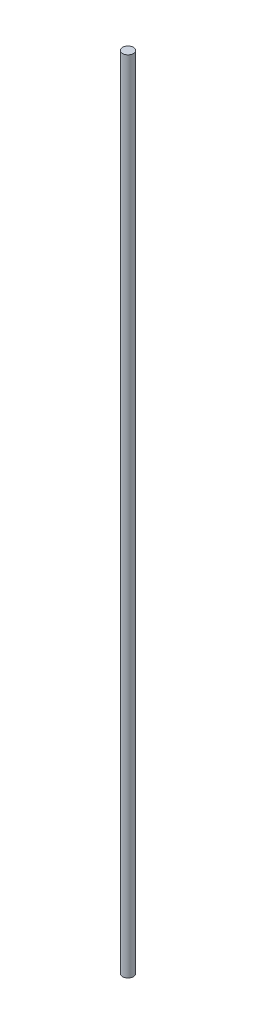
from build123d import *

# Parameters (mm, degrees)
SKETCH1_R           = 6.35
BOSS_EXTRUDE1_DEPTH = 935.5


with BuildPart() as part:
    # Sketch1 → Boss-Extrude1 (new body)
    with BuildSketch(Plane(origin=(0, 0, 0), x_dir=(1, 0, 0), z_dir=(0, 1, 0))):
        with Locations(Location((0, 0, 0), (0, 0, 90))):
            Circle(SKETCH1_R)
    extrude(amount=BOSS_EXTRUDE1_DEPTH)


solid = part.part
